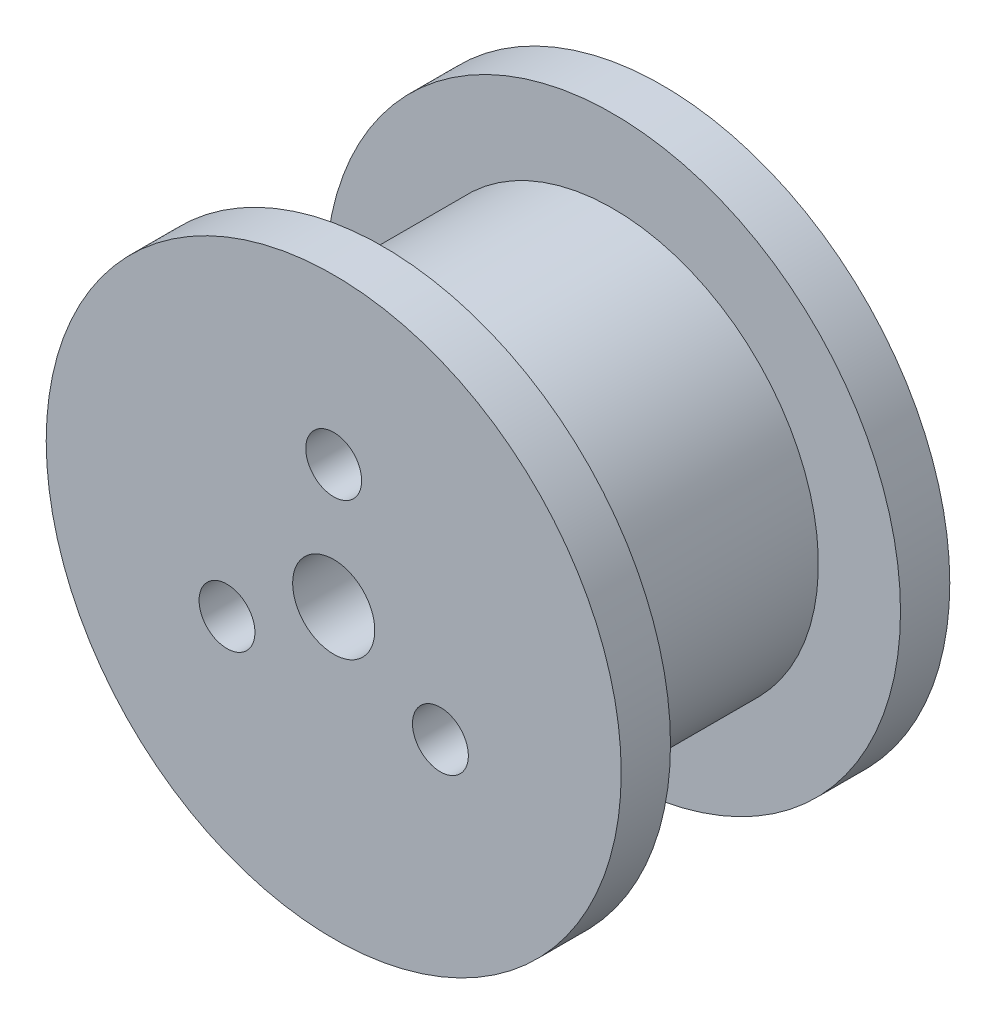
from build123d import *

# Parameters (mm, degrees)
ESQUISSE1_R             = 17.5
BOSS_EXTRU_1_DEPTH      = 20
ESQUISSE3_W             = 14
ESQUISSE3_H             = 5
ESQUISSE4_R             = 2.5
ENL_V_MAT_EXTRU_1_DEPTH = 20
D_GAGEMENT_M31_D        = 3.4


with BuildPart() as part:
    # Esquisse1 → Boss.-Extru.1 (new body)
    with BuildSketch(Plane.XY):
        Circle(ESQUISSE1_R)
    extrude(amount=BOSS_EXTRU_1_DEPTH)

    # Esquisse3 → Enlèvement de matière-Révolution2 (revolve, cut)
    with BuildSketch(Plane(origin=(0, 0, 0), x_dir=(0, 0, -1), z_dir=(1, 0, 0)), mode=Mode.PRIVATE) as enl_vement_de_mati_re_r_volution2_sk:
        with Locations((-10, 15)):
            Rectangle(ESQUISSE3_W, ESQUISSE3_H)
    revolve(enl_vement_de_mati_re_r_volution2_sk.sketch.rotate(Axis((0, 0, 0), (0, 0, 1)), 90), axis=Axis((0, 0, 0), (0, 0, 1)), mode=Mode.SUBTRACT)

    # Esquisse4 → Enlèv. mat.-Extru.1 (cut)
    with BuildSketch(Plane(origin=(0, 0, 0), x_dir=(-1, 0, 0), z_dir=(0, 0, -1))):
        Circle(ESQUISSE4_R)
    extrude(amount=-ENL_V_MAT_EXTRU_1_DEPTH, mode=Mode.SUBTRACT)

    # Dégagement M31 (through all)
    with Locations(Plane(origin=(0, 0, 0), x_dir=(-1, 0, 0), z_dir=(0, 0, -1))):
        with Locations((0, 7.5), (6.495190528, -3.75), (-6.495190528, -3.75), (0, 0)):
            Hole(D_GAGEMENT_M31_D / 2)


solid = part.part
